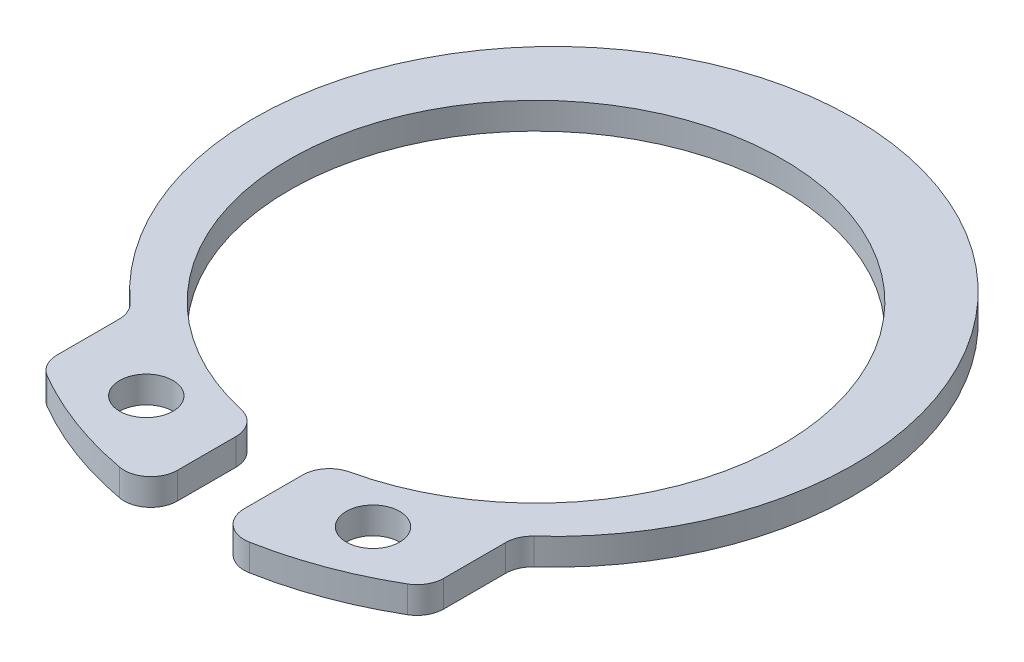
from build123d import *

# Parameters (mm, degrees)
SKETCH_1_R      = 1
EXTRUDE_1_DEPTH = 0.5
FILLET_1_R      = 1


with BuildPart() as part:
    # 草图1 → 凸台-拉伸1 (new, symmetric)
    with BuildSketch(Plane(origin=(0, 0, 0), x_dir=(1, 0, 0), z_dir=(0, 1, 0))):
        with BuildLine():
            Line((-1.25, -13.341570372), (-1.25, -9.16515139))
            ThreePointArc((-1.25, -9.16515139), (0, 9.25), (1.25, -9.16515139))
            Line((1.25, -9.16515139), (1.25, -13.341570372))
            ThreePointArc((1.25, -13.341570372), (4.374478114, -12.665857303), (7.25, -11.269316749))
            Line((7.25, -11.269316749), (7.25, -7.932325267))
            ThreePointArc((7.25, -7.932325267), (0, 11.92), (-7.25, -7.932325267))
            Line((-7.25, -7.932325267), (-7.25, -11.269316749))
            ThreePointArc((-7.25, -11.269316749), (-4.374478114, -12.665857303), (-1.25, -13.341570372))
        make_face()
        with Locations(Location((-4.25, -10.362311518, 0), (0, 0, 270))):
            Circle(SKETCH_1_R, mode=Mode.SUBTRACT)
        with Locations(Location((4.25, -10.362311518, 0), (0, 0, 90))):
            Circle(SKETCH_1_R, mode=Mode.SUBTRACT)
    extrude(amount=EXTRUDE_1_DEPTH, both=True)

    # 圆角1
    fillet_1_edges = [part.edges().sort_by_distance(p)[0] for p in [
        (7.25, 0, 7.932325267),
        (7.25, 0, 11.269316749),
        (1.25, 0, 13.341570372),
        (1.25, 0, 9.16515139),
        (-1.25, 0, 9.16515139),
        (-1.25, 0, 13.341570372),
        (-7.25, 0, 11.269316749),
        (-7.25, 0, 7.932325267),
    ]]
    fillet(fillet_1_edges, radius=FILLET_1_R)


solid = part.part
